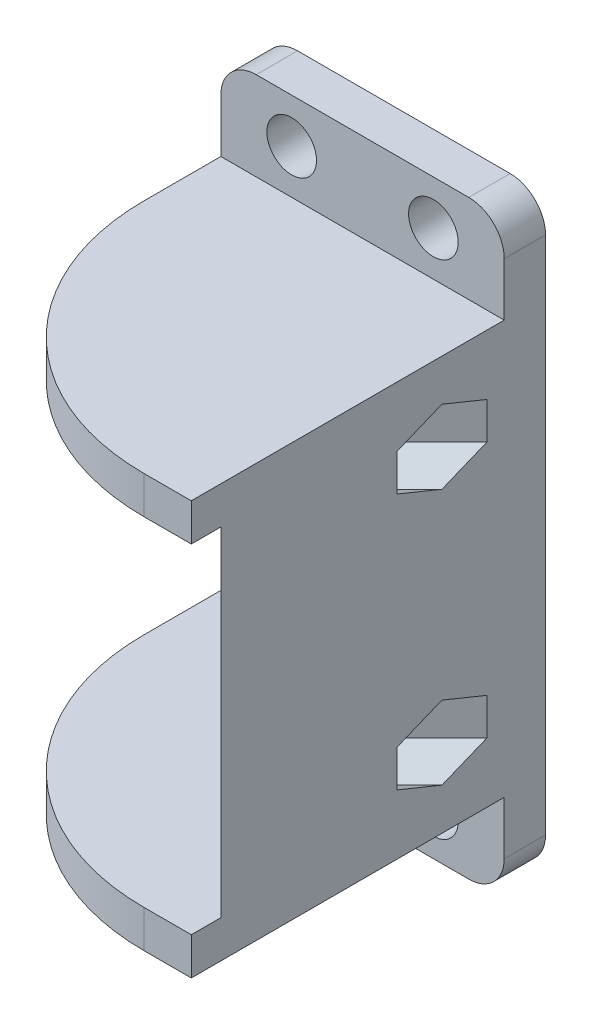
from build123d import *

# Parameters (mm, degrees)
SKETCH6_W           = 24
SKETCH6_H           = 30
BOSS_EXTRUDE5_DEPTH = 35
CUT_EXTRUDE1_DEPTH  = 14.325
FILLET1_R           = 20
SKETCH11_R          = 1.65
CUT_EXTRUDE3_DEPTH  = 41.095199214
CUT_EXTRUDE8_DEPTH  = 14
SKETCH14_W          = 24
SKETCH14_H          = 50
BOSS_EXTRUDE6_DEPTH = 3.5
SKETCH15_R          = 2.1
CUT_EXTRUDE9_DEPTH  = 3.5
FILLET2_R           = 3


with BuildPart() as part:
    # Sketch6 → Boss-Extrude5 (new body)
    with BuildSketch(Plane(origin=(0, 0, 0), x_dir=(1, 0, 0), z_dir=(0, 1, 0))):
        Rectangle(SKETCH6_W, SKETCH6_H)
    extrude(amount=BOSS_EXTRUDE5_DEPTH)

    # Sketch8 → Cut-Extrude1 (cut)
    with BuildSketch(Plane(origin=(0, 17.5, 0), x_dir=(1, 0, 0), z_dir=(0, 1, 0))):
        Polygon((-12, 11.5), (-12, -15), (14.5, -15), align=None)
    cut_extrude1 = extrude(amount=-CUT_EXTRUDE1_DEPTH, mode=Mode.SUBTRACT)

    # Mirror2: Cut-Extrude1 across plane
    add(cut_extrude1.mirror(Plane.ZX.offset(17.5)), mode=Mode.SUBTRACT)

    # Fillet1
    fillet1_edges = [part.edges().sort_by_distance(p)[0] for p in [
        (-12, 1.5875, 15),
        (-12, 33.4125, 15),
    ]]
    fillet(fillet1_edges, radius=FILLET1_R)

    # Sketch11 → Cut-Extrude3 (cut, through all)
    with BuildSketch(Plane(origin=(-0.25, 0, 0.25), x_dir=(0.7071067811865439, 0, 0.7071067811865511), z_dir=(-0.7071067811865511, 0, 0.7071067811865439))):
        with Locations((4.084116139, 6.65)):
            Circle(SKETCH11_R)
        with Locations((4.084116139, 28.35)):
            Circle(SKETCH11_R)
    extrude(amount=-CUT_EXTRUDE3_DEPTH, mode=Mode.SUBTRACT)

    # Sketch12 → Cut-Extrude8 (cut)
    with BuildSketch(Plane(origin=(13.892135624, 0, -13.892135624), x_dir=(0.7071067811865439, 0, 0.7071067811865511), z_dir=(-0.7071067811865511, 0, 0.7071067811865439))):
        Polygon((6.784116139, 8.208845727), (4.084116139, 9.767691454), (1.384116139, 8.208845727), (1.384116139, 5.091154273), (4.084116139, 3.532308546), (6.784116139, 5.091154273), align=None)
        Polygon((6.784116139, 29.908845727), (6.784116139, 26.791154273), (4.084116139, 25.232308546), (1.384116139, 26.791154273), (1.384116139, 29.908845727), (4.084116139, 31.467691454), align=None)
    extrude(amount=CUT_EXTRUDE8_DEPTH, mode=Mode.SUBTRACT)

    # Sketch14 → Boss-Extrude6 (add)
    with BuildSketch(Plane(origin=(0, 0, -15), x_dir=(-1, 0, 0), z_dir=(0, 0, -1))):
        with Locations((0, 17.5)):
            Rectangle(SKETCH14_W, SKETCH14_H)
    extrude(amount=-BOSS_EXTRUDE6_DEPTH)

    # Sketch15 → Cut-Extrude9 (cut)
    with BuildSketch(Plane.XY.offset(-11.5)):
        with Locations((6, 38.75)):
            Circle(SKETCH15_R)
        with Locations((-6, 38.75)):
            Circle(SKETCH15_R)
        with Locations((-6, -3.75)):
            Circle(SKETCH15_R)
        with Locations((6, -3.75)):
            Circle(SKETCH15_R)
    extrude(amount=-CUT_EXTRUDE9_DEPTH, mode=Mode.SUBTRACT)

    # Fillet2
    fillet2_edges = [part.edges().sort_by_distance(p)[0] for p in [
        (12, -7.5, -13.25),
        (-12, 42.5, -13.25),
        (-12, -7.5, -13.25),
        (12, 42.5, -13.25),
    ]]
    fillet(fillet2_edges, radius=FILLET2_R)


solid = part.part
